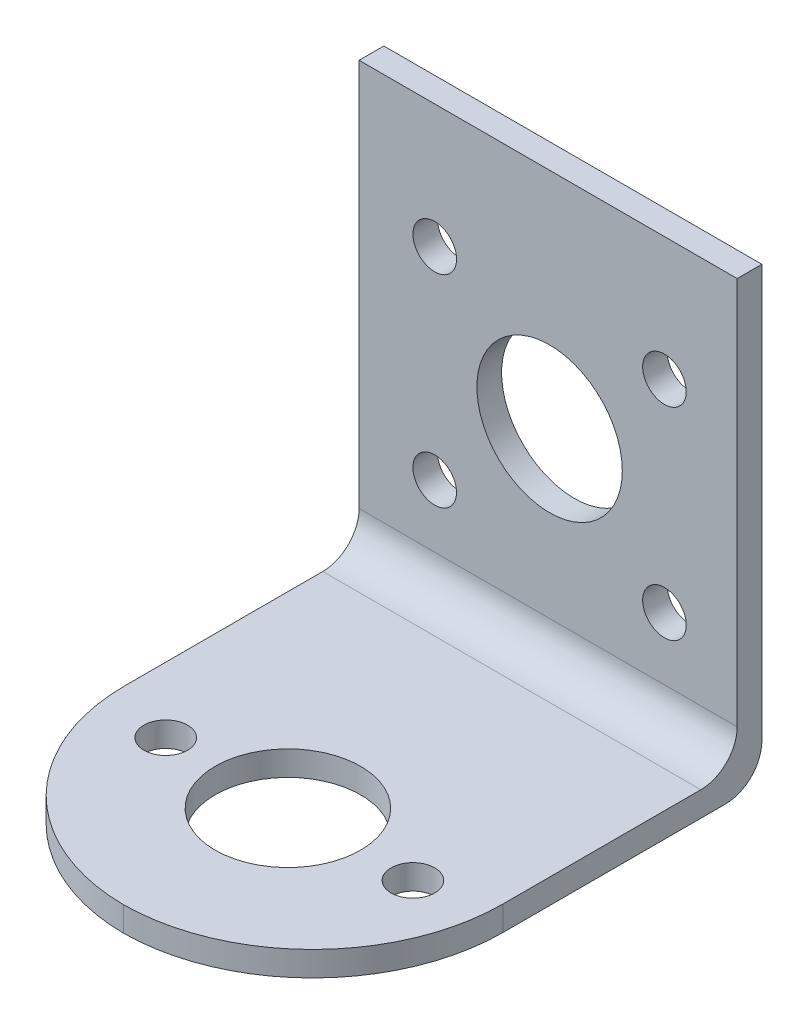
from build123d import *

# Parameters (mm, degrees)
BOSS_EXTRUDE1_DEPTH        = 1.7
SKETCH2_W                  = 26
SKETCH2_H                  = 1.7
BOSS_EXTRUDE2_DEPTH        = 29.2
F_10_0_10_DIAMETER_HOLE1_D = 10
F_3_0_3_DIAMETER_HOLE1_D   = 3
F_10_0_10_DIAMETER_HOLE2_D = 10
F_3_0_3_DIAMETER_HOLE2_D   = 3
FILLET1_R                  = 2.5


with BuildPart() as part:
    # Sketch1 → Boss-Extrude1 (new body)
    with BuildSketch(Plane(origin=(0, -13.75, 0), x_dir=(1, 0, 0), z_dir=(0, 1, 0))):
        with BuildLine():
            Line((13.000000223, -17.8), (13.000000223, 0))
            Line((13.000000223, 0), (-13, 0))
            Line((-13, 0), (-13, -17.8))
            ThreePointArc((-13, -17.8), (-9.198386918, -27.027675803), (1.11e-07, -30.899618316))
            ThreePointArc((1.11e-07, -30.899618316), (9.19838714, -27.027675803), (13.000000223, -17.8))
        make_face()
    extrude(amount=-BOSS_EXTRUDE1_DEPTH)

    # Sketch2 → Boss-Extrude2 (add)
    with BuildSketch(Plane(origin=(0, -13.75, 0), x_dir=(-1, 0, 0), z_dir=(0, 1, 0))):
        with Locations((0, 0.85)):
            Rectangle(SKETCH2_W, SKETCH2_H)
    extrude(amount=BOSS_EXTRUDE2_DEPTH)

    # Ø10.0 (10) Diameter Hole1 (through all)
    with Locations(Plane(origin=(0, -13.75, 0), x_dir=(1, 0, 0), z_dir=(0, 1, 0))):
        with Locations((-0.099999806, -19.5)):
            Hole(F_10_0_10_DIAMETER_HOLE1_D / 2)

    # Ø3.0 (3) Diameter Hole1 (through all)
    with Locations(Plane(origin=(0, -13.75, 0), x_dir=(1, 0, 0), z_dir=(0, 1, 0))):
        with Locations((8.5, -19.5), (-8.5, -19.5)):
            Hole(F_3_0_3_DIAMETER_HOLE1_D / 2)

    # Ø10.0 (10) Diameter Hole2 (through all)
    with Locations(Plane.XY.offset(1.7)):
        with Locations((0.1, 0.05)):
            Hole(F_10_0_10_DIAMETER_HOLE2_D / 2)

    # Ø3.0 (3) Diameter Hole2 (through all)
    with Locations(Plane.XY.offset(1.7)):
        with Locations((-7.8, 6.95), (8, -6.95), (-7.8, -6.95), (8, 6.95)):
            Hole(F_3_0_3_DIAMETER_HOLE2_D / 2)

    # Fillet1
    fillet1_edges = [part.edges().sort_by_distance(p)[0] for p in [
        (1.11e-07, -15.45, 0),
        (0, -13.75, 1.7),
    ]]
    fillet(fillet1_edges, radius=FILLET1_R)


solid = part.part
